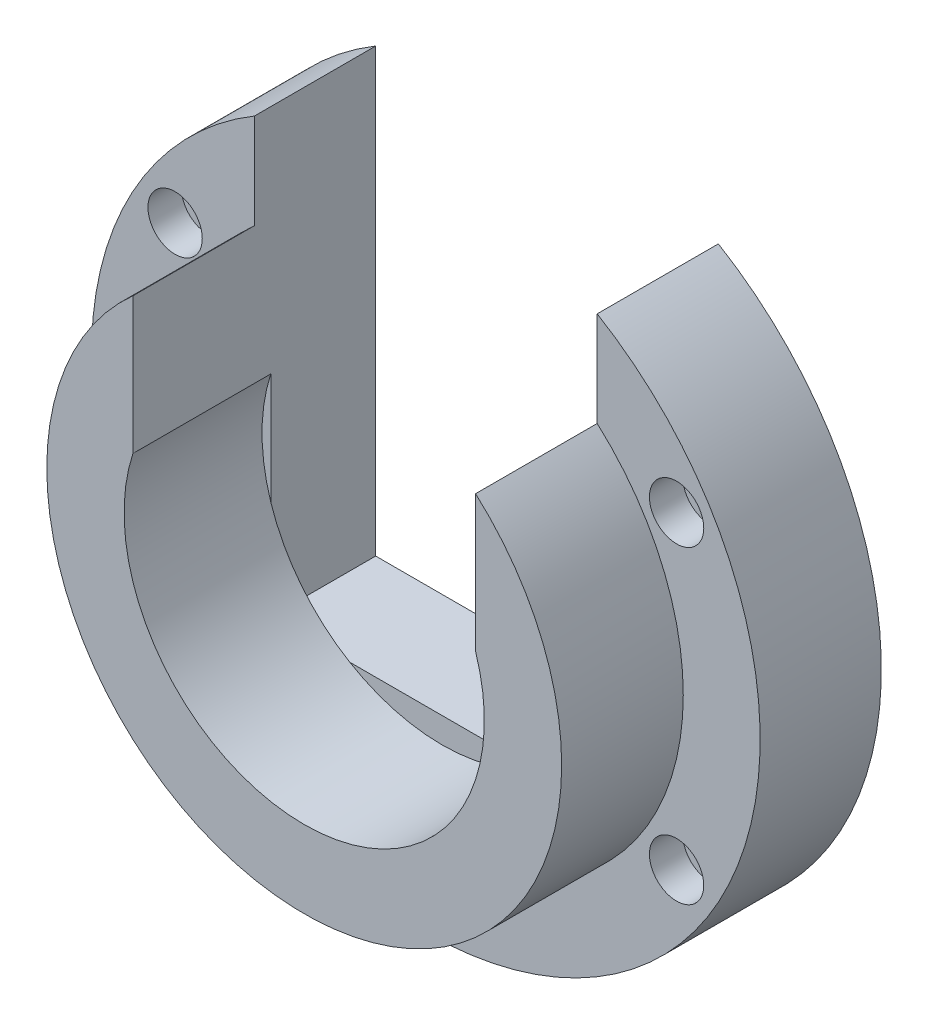
from build123d import *

# Parameters (mm, degrees)
BOSS_EXTRUDE1_DEPTH = 14.5
SKETCH1_R           = 21.549999999999997
CUT_EXTRUDE1_DEPTH  = 1.95
BOSS_EXTRUDE3_START = 14.55
BOSS_EXTRUDE3_DEPTH = 16.5
SKETCH4_R           = 1.6999999999999995
CUT_EXTRUDE2_DEPTH  = 59.40978085903079
SKETCH5_R           = 3.2500000000000004
CUT_EXTRUDE3_DEPTH  = 4


with BuildPart() as part:
    # Sketch2 → Boss-Extrude1 (new body)
    with BuildSketch(Plane.XY):
        with BuildLine():
            Line((-20.50000000000001, -18.5), (-20.500000000000018, 34.34748899119118))
            ThreePointArc((-20.500000000000014, 34.347488991191184), (-19.7484176581315, -34.78505426185217), (40, -9.8e-15))
            ThreePointArc((40, 0), (34.785054261852174, 19.748417658131498), (20.500000000000004, 34.347488991191184))
            Line((20.5, 34.347488991191184), (20.5, -18.5))
            Line((20.500000000000004, -18.5), (-20.50000000000001, -18.5))
        make_face()
    extrude(amount=BOSS_EXTRUDE1_DEPTH)

    # Sketch1 → Cut-Extrude1 (cut)
    with BuildSketch(Plane.XY.offset(14.5)):
        Circle(SKETCH1_R)
    extrude(amount=-CUT_EXTRUDE1_DEPTH, mode=Mode.SUBTRACT)

    # Sketch1<3> → Boss-Extrude3 (add)
    with BuildSketch(Plane.XY.offset(14.5).offset(BOSS_EXTRUDE3_START)):
        with BuildLine():
            Line((20.5, -6.644734757685281), (20.5, -18.5))
            Line((20.5, -18.5), (11.052262211872641, -18.5))
            ThreePointArc((11.052262211872707, -18.500000000000284), (-5.0161e-13, -21.549999999999997), (-11.052262211873552, -18.49999999999978))
            Line((-11.0522622118736, -18.5), (-20.500000000000014, -18.5))
            Line((-20.50000000000001, -18.5), (-20.50000000000001, -6.644734757685747))
            ThreePointArc((-20.500000000000068, -6.644734757685756), (-21.549999999999997, 2.64e-15), (-20.500000000000064, 6.64473475768576))
            Line((-20.500000000000014, 6.644734757685754), (-20.500000000000018, 22.986735305389928))
            ThreePointArc((-20.499999999998952, 22.98673530538957), (-12.594443219135018, -28.107294426891826), (30.800000000000004, -7.54e-15))
            ThreePointArc((30.800000000000004, 0), (28.107294426892086, 12.594443219134437), (20.499999999999915, 22.98673530538871))
            Line((20.5, 22.98673530538874), (20.5, 6.644734757685303))
            ThreePointArc((20.500000000000203, 6.644734757685333), (21.285881471059685, 3.3635918301716967), (21.549999999999997, 0))
            ThreePointArc((21.549999999999997, -5.28e-15), (21.285881471059685, -3.3635918301717003), (20.500000000000206, -6.644734757685318))
        make_face()
        with BuildLine():
            Line((-20.500000000000014, -18.5), (-11.0522622118736, -18.5))
            ThreePointArc((-11.052262211873552, -18.49999999999978), (-16.852986120065246, -13.430538292893852), (-20.500000000000068, -6.644734757685756))
            Line((-20.50000000000001, -6.644734757685747), (-20.50000000000001, -18.5))
        make_face()
        with BuildLine():
            Line((11.052262211872641, -18.5), (20.5, -18.5))
            Line((20.5, -18.5), (20.5, -6.644734757685281))
            ThreePointArc((20.500000000000206, -6.644734757685318), (16.852986120065083, -13.430538292894052), (11.052262211872707, -18.500000000000284))
        make_face()
    extrude(amount=-BOSS_EXTRUDE3_DEPTH)

    # Sketch4 → Cut-Extrude2 (cut, through all)
    with BuildSketch(Plane.XY.offset(14.5)):
        with Locations((30, 18.508444018879594)):
            Circle(SKETCH4_R)
        with Locations((30, -18.508444018879594)):
            Circle(SKETCH4_R)
        with Locations((-30, 18.508444018879594)):
            Circle(SKETCH4_R)
        with Locations((-30, -18.508444018879594)):
            Circle(SKETCH4_R)
    extrude(amount=-CUT_EXTRUDE2_DEPTH, mode=Mode.SUBTRACT)

    # Sketch5 → Cut-Extrude3 (cut)
    with BuildSketch(Plane.XY.offset(14.5)):
        with Locations((-30, 18.508444018879594)):
            Circle(SKETCH5_R)
        with Locations((30, 18.508444018879594)):
            Circle(SKETCH5_R)
        with Locations((30, -18.508444018879594)):
            Circle(SKETCH5_R)
        with Locations((-30, -18.508444018879594)):
            Circle(SKETCH5_R)
    extrude(amount=-CUT_EXTRUDE3_DEPTH, mode=Mode.SUBTRACT)


solid = part.part
